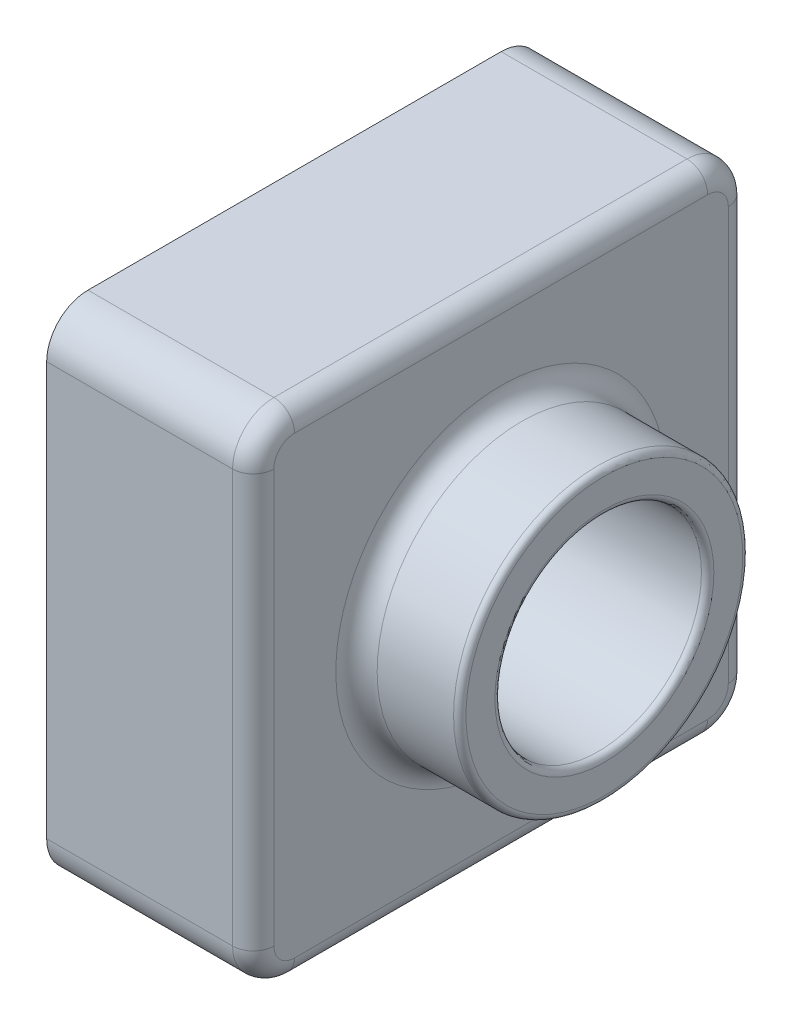
from build123d import *

# Parameters (mm, degrees)
SKETCH1_W               = 120
SKETCH1_H               = 120
BOSS_EXTRUDE1_DEPTH     = 50
SKETCH2_R               = 35
BOSS_EXTRUDE2_DEPTH     = 25
CUT_EXTRUDE1_DEPTH      = 186.539753153
CUT_EXTRUDE1_DEPTH_BACK = 186.539753153
SKETCH3_R               = 25
FILLET2_R               = 10
FILLET3_R               = 1.5
FILLET5_R               = 5
SHELL1_T                = -2


with BuildPart() as part:
    # Sketch1 → Boss-Extrude1 (new body)
    with BuildSketch(Plane(origin=(0, 0, 0), x_dir=(0, 0, -1), z_dir=(1, 0, 0))):
        with Locations((-60, 60)):
            Rectangle(SKETCH1_W, SKETCH1_H)
    extrude(amount=BOSS_EXTRUDE1_DEPTH)

    # Sketch2 → Boss-Extrude2 (add)
    with BuildSketch(Plane(origin=(50, 0, 0), x_dir=(0, 0, -1), z_dir=(1, 0, 0))):
        with Locations((-60, 60)):
            Circle(SKETCH2_R)
    extrude(amount=BOSS_EXTRUDE2_DEPTH)

    # Sketch3 → Cut-Extrude1 (cut, two sides: drawn at the far end of the back side and taken through both)
    with BuildSketch(Plane(origin=(75, 0, 0), x_dir=(0, 0, -1), z_dir=(1, 0, 0)).offset(-CUT_EXTRUDE1_DEPTH_BACK)):
        with Locations((-60, 60)):
            Circle(SKETCH3_R)
    extrude(amount=CUT_EXTRUDE1_DEPTH + CUT_EXTRUDE1_DEPTH_BACK, mode=Mode.SUBTRACT)

    # Fillet2
    fillet2_edges = [part.edges().sort_by_distance(p)[0] for p in [
        (25, 0, 0),
        (25, 0, 120),
        (25, 120, 120),
        (25, 120, 0),
    ]]
    fillet(fillet2_edges, radius=FILLET2_R)

    # Fillet3
    fillet3_edges = [part.edges().sort_by_distance(p)[0] for p in [
        (75, 60, 85),
        (75, 60, 95),
    ]]
    fillet(fillet3_edges, radius=FILLET3_R)

    # Fillet5
    fillet5_edges = [part.edges().sort_by_distance(p)[0] for p in [
        (50, 60, 95),
        (50, 60, 0),
        (50, 0, 60),
        (50, 120, 60),
        (50, 60, 120),
        (50, 117.071067812, 2.928932188),
        (50, 117.071067812, 117.071067812),
        (50, 2.928932188, 117.071067812),
        (50, 2.928932188, 2.928932188),
    ]]
    fillet(fillet5_edges, radius=FILLET5_R)

    # Shell1
    shell1_openings = [part.faces().sort_by_distance(p)[0] for p in [
        (0, 1.697056275, 60),
    ]]
    offset(amount=SHELL1_T, openings=shell1_openings, kind=Kind.INTERSECTION)


solid = part.part
